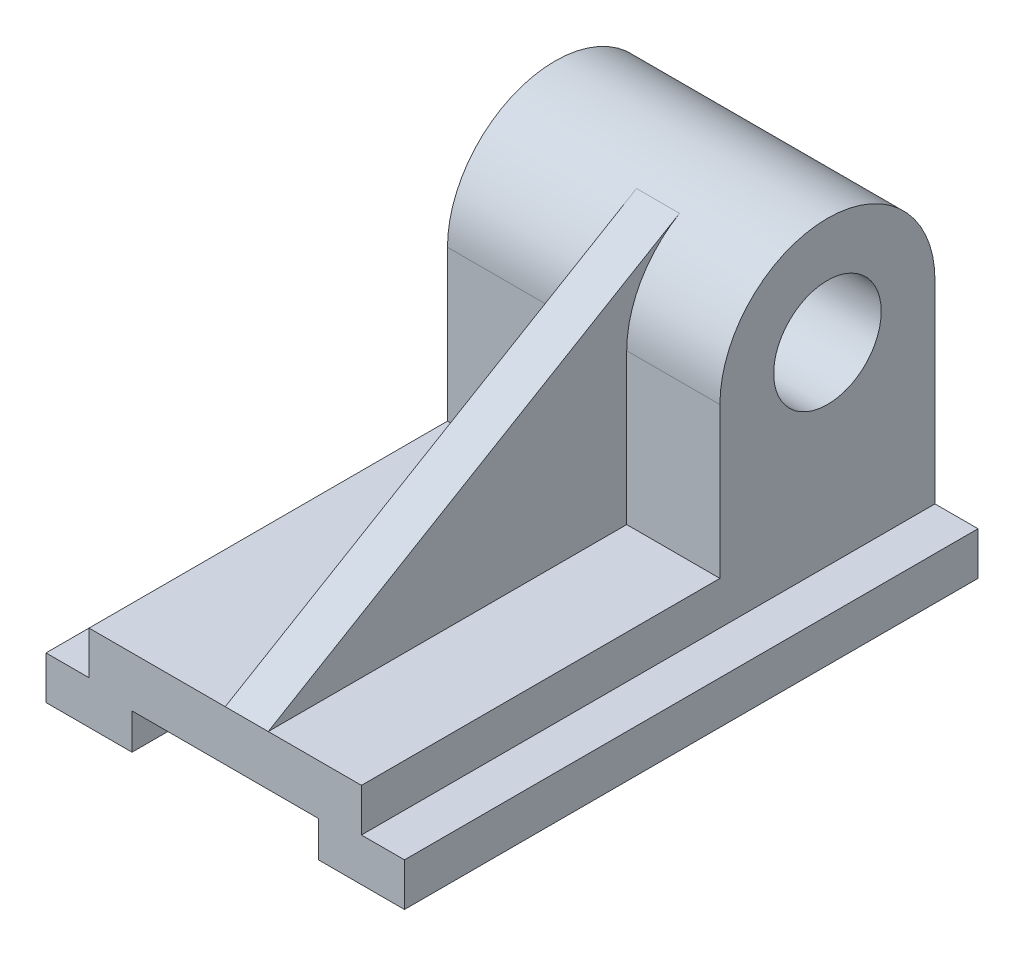
from build123d import *

# Parameters (mm, degrees)
BOSS_EXTRUDE1_DEPTH = 160
SKETCH3_R           = 15
BOSS_EXTRUDE3_DEPTH = 76
RIB2_REACH          = 196.813
SKETCH5_WALL_W      = 524.907117832
SKETCH5_WALL_H      = 12


with BuildPart() as part:
    # Sketch2 → Boss-Extrude1 (new body)
    with BuildSketch(Plane.XY):
        Polygon((0, 0), (0, 12), (12, 12), (12, 24), (88, 24), (88, 12), (100, 12), (100, 0), (76, 0), (76, 10), (24, 10), (24, 0), align=None)
    extrude(amount=-BOSS_EXTRUDE1_DEPTH)

    # Sketch3 → Boss-Extrude3 (add)
    with BuildSketch(Plane(origin=(88, 0, 0), x_dir=(0, 0, -1), z_dir=(1, 0, 0))):
        with BuildLine():
            Line((100, 24), (100, 66))
            ThreePointArc((100, 66), (130, 96), (160, 66))
            Line((160, 66), (160, 24))
            Line((160, 24), (100, 24))
        make_face()
        with Locations((130, 66)):
            Circle(SKETCH3_R, mode=Mode.SUBTRACT)
    extrude(amount=-BOSS_EXTRUDE3_DEPTH)

    # Sketch5 wall → Rib2 (add, up to next)
    with BuildSketch(Plane(origin=(56, 57.912517706, -57.366725049), x_dir=(0, 0.508884996756, -0.860834513758), z_dir=(0, 0.860834513758, 0.508884996756)), mode=Mode.PRIVATE) as rib2_sk1:
        Rectangle(SKETCH5_WALL_W, SKETCH5_WALL_H)
    rib2_tool1 = extrude(rib2_sk1.sketch, amount=-RIB2_REACH, mode=Mode.PRIVATE) - part.part
    add(rib2_tool1.solids().sort_by_distance((56, 57.912517706, -57.366725049))[0])


solid = part.part
